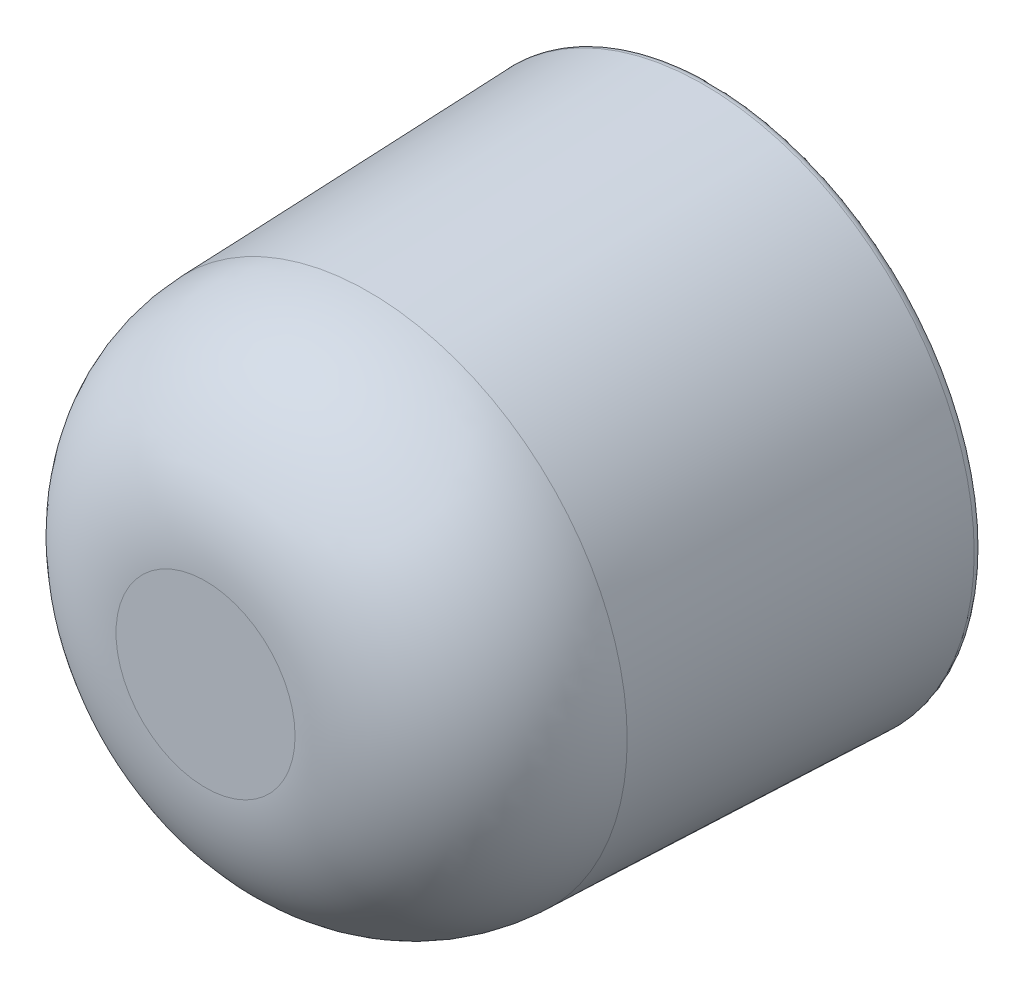
from build123d import *

# Parameters (mm, degrees)
ESQUISSE1_R             = 8
BOSS_EXTRU_1_DEPTH      = 15
BOSS_EXTRU_1_TAPER      = 2
CONG_1_R                = 5
ESQUISSE2_R             = 3
ENL_V_MAT_EXTRU_1_DEPTH = 12
ESQUISSE3_R             = 7.5
ENL_V_MAT_EXTRU_2_DEPTH = 5
CONG_2_R                = 0.25


with BuildPart() as part:
    # Esquisse1 → Boss.-Extru.1 (new body)
    with BuildSketch(Plane.XY):
        Circle(ESQUISSE1_R)
    extrude(amount=BOSS_EXTRU_1_DEPTH, taper=BOSS_EXTRU_1_TAPER)

    # Congé1
    cong_1_edges = [part.edges().sort_by_distance(p)[0] for p in [
        (-7.476188458, 0, 15),
    ]]
    fillet(cong_1_edges, radius=CONG_1_R)

    # Esquisse2 → Enlèv. mat.-Extru.1 (cut)
    with BuildSketch(Plane(origin=(0, 0, 0), x_dir=(-1, 0, 0), z_dir=(0, 0, -1))):
        Circle(ESQUISSE2_R)
    extrude(amount=-ENL_V_MAT_EXTRU_1_DEPTH, mode=Mode.SUBTRACT)

    # Esquisse3 → Enlèv. mat.-Extru.2 (cut)
    with BuildSketch(Plane(origin=(0, 0, 0), x_dir=(-1, 0, 0), z_dir=(0, 0, -1))):
        Circle(ESQUISSE3_R)
    extrude(amount=-ENL_V_MAT_EXTRU_2_DEPTH, mode=Mode.SUBTRACT)

    # Congé2
    cong_2_edges = [part.edges().sort_by_distance(p)[0] for p in [
        (-8, 0, 0),
    ]]
    fillet(cong_2_edges, radius=CONG_2_R)


solid = part.part
